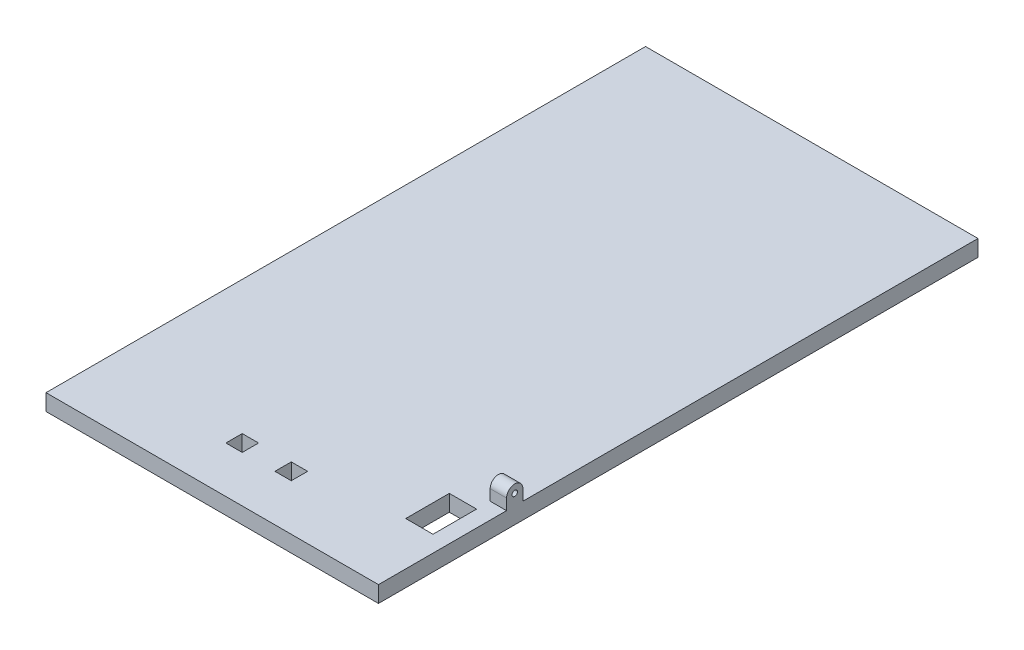
from build123d import *

# Parameters (mm, degrees)
SKETCH1_W           = 61
SKETCH1_H           = 100
BOSS_EXTRUDE1_DEPTH = 3
SKETCH3_R           = 1.5
BOSS_EXTRUDE7_DEPTH = 3
LPATTERN1_COUNT     = 2
LPATTERN1_PITCH     = 15
SKETCH6_W           = 5
SKETCH6_H           = 8
CUT_EXTRUDE1_DEPTH  = 5
SKETCH4_W           = 61
SKETCH4_H           = 3
BOSS_EXTRUDE3_DEPTH = 10
SKETCH8_R           = 0.5
BOSS_EXTRUDE6_DEPTH = 3
SKETCH9_W           = 3
SKETCH9_H           = 3
CUT_EXTRUDE3_DEPTH  = 3


with BuildPart() as part:
    # Sketch1 → Boss-Extrude1 (new body)
    with BuildSketch(Plane(origin=(0, 0, 0), x_dir=(1, 0, 0), z_dir=(0, 1, 0))):
        with Locations((30.5, 50)):
            Rectangle(SKETCH1_W, SKETCH1_H)
    extrude(amount=BOSS_EXTRUDE1_DEPTH)

    # Sketch3 → Boss-Extrude7 (add)
    with BuildSketch(Plane(origin=(24.5, 0, 0), x_dir=(0, 0, -1), z_dir=(1, 0, 0))):
        Circle(SKETCH3_R)
    boss_extrude7 = extrude(amount=-BOSS_EXTRUDE7_DEPTH)

    # LPattern1: Boss-Extrude7 ×2
    with Locations(*[(i * LPATTERN1_PITCH, 0, 0) for i in range(1, LPATTERN1_COUNT)]):
        add(boss_extrude7)

    # Sketch6 → Cut-Extrude1 (cut)
    with BuildSketch(Plane(origin=(0, 3, 0), x_dir=(1, 0, 0), z_dir=(0, 1, 0))):
        with Locations((55.5, 7)):
            Rectangle(SKETCH6_W, SKETCH6_H)
    extrude(amount=-CUT_EXTRUDE1_DEPTH, mode=Mode.SUBTRACT)

    # Sketch4 → Boss-Extrude3 (add)
    with BuildSketch(Plane.XY):
        with Locations((30.5, 1.5)):
            Rectangle(SKETCH4_W, SKETCH4_H)
    extrude(amount=BOSS_EXTRUDE3_DEPTH)

    # Sketch8 → Boss-Extrude6 (add)
    with BuildSketch(Plane(origin=(61, 0, 0), x_dir=(0, 0, -1), z_dir=(1, 0, 0))):
        with BuildLine():
            Line((13.5, 3), (16.5, 3))
            Line((16.5, 3), (16.5, 5))
            ThreePointArc((16.5, 5), (15, 6.5), (13.5, 5))
            Line((13.5, 5), (13.5, 3))
        make_face()
        with Locations(Location((15, 5, 0), (0, 0, 180))):
            Circle(SKETCH8_R, mode=Mode.SUBTRACT)
    extrude(amount=-BOSS_EXTRUDE6_DEPTH)

    # Sketch9 → Cut-Extrude3 (cut)
    with BuildSketch(Plane.XZ):
        with Locations((35, 0)):
            Rectangle(SKETCH9_W, SKETCH9_H)
        with Locations((26, 0)):
            Rectangle(SKETCH9_W, SKETCH9_H)
    extrude(amount=-CUT_EXTRUDE3_DEPTH, mode=Mode.SUBTRACT)


solid = part.part
